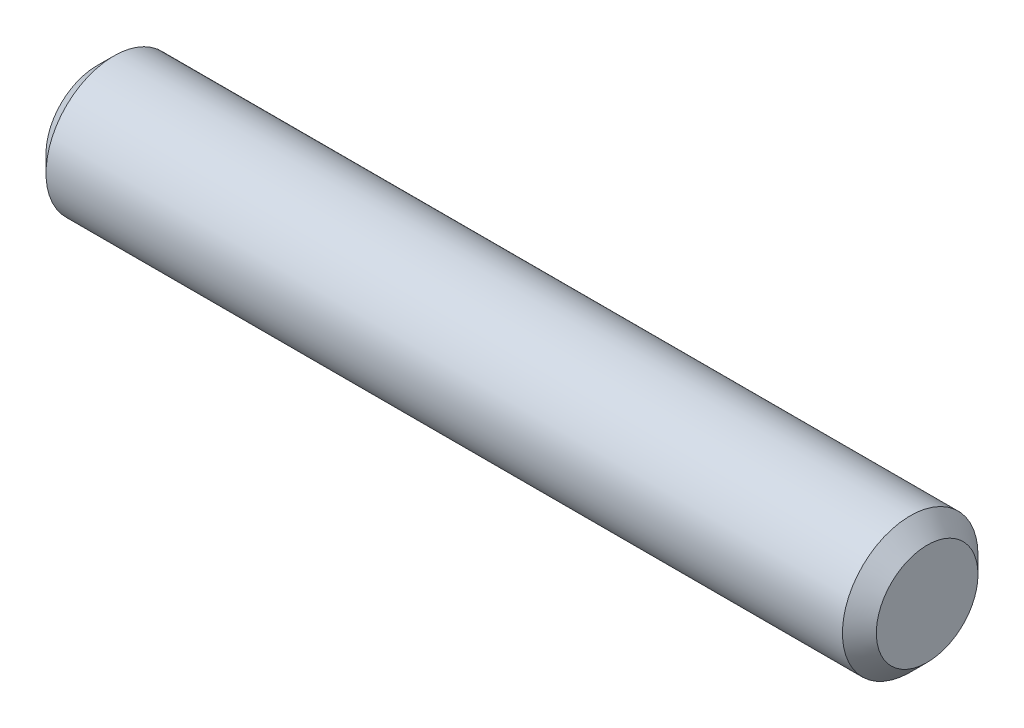
from build123d import *

# Parameters (mm, degrees)
SKETCH1_R           = 4
BOSS_EXTRUDE1_DEPTH = 24.5
CHAMFER1_SIZE       = 1


with BuildPart() as part:
    # Sketch1 → Boss-Extrude1 (new, symmetric)
    with BuildSketch(Plane(origin=(0, 0, 0), x_dir=(0, 0, -1), z_dir=(1, 0, 0))):
        Circle(SKETCH1_R)
    extrude(amount=BOSS_EXTRUDE1_DEPTH, both=True)

    # Chamfer1
    chamfer1_edges = [part.edges().sort_by_distance(p)[0] for p in [
        (-24.5, 0, 4),
        (24.5, 0, 4),
    ]]
    chamfer(chamfer1_edges, length=CHAMFER1_SIZE)


solid = part.part
